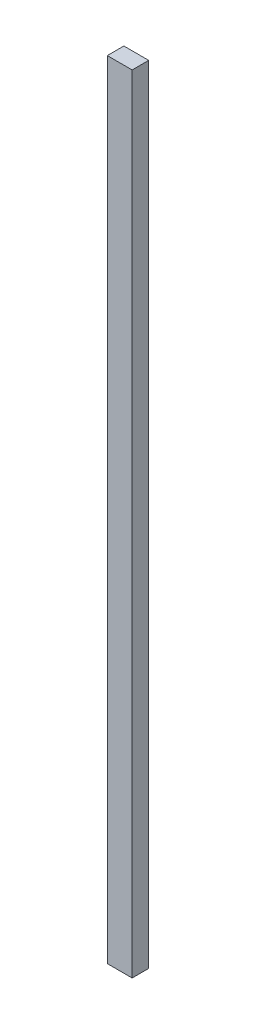
from build123d import *

# Parameters (mm, degrees)
SKETCH1_W           = 12
SKETCH1_H           = 379.5
BOSS_EXTRUDE1_DEPTH = 8


with BuildPart() as part:
    # Sketch1 → Boss-Extrude1 (new body)
    with BuildSketch(Plane(origin=(0, 0, -41.306573009), x_dir=(-1, 0, 0), z_dir=(0, 0, -1))):
        with Locations((0, 414.381527043)):
            Rectangle(SKETCH1_W, SKETCH1_H)
    extrude(amount=BOSS_EXTRUDE1_DEPTH)


solid = part.part
